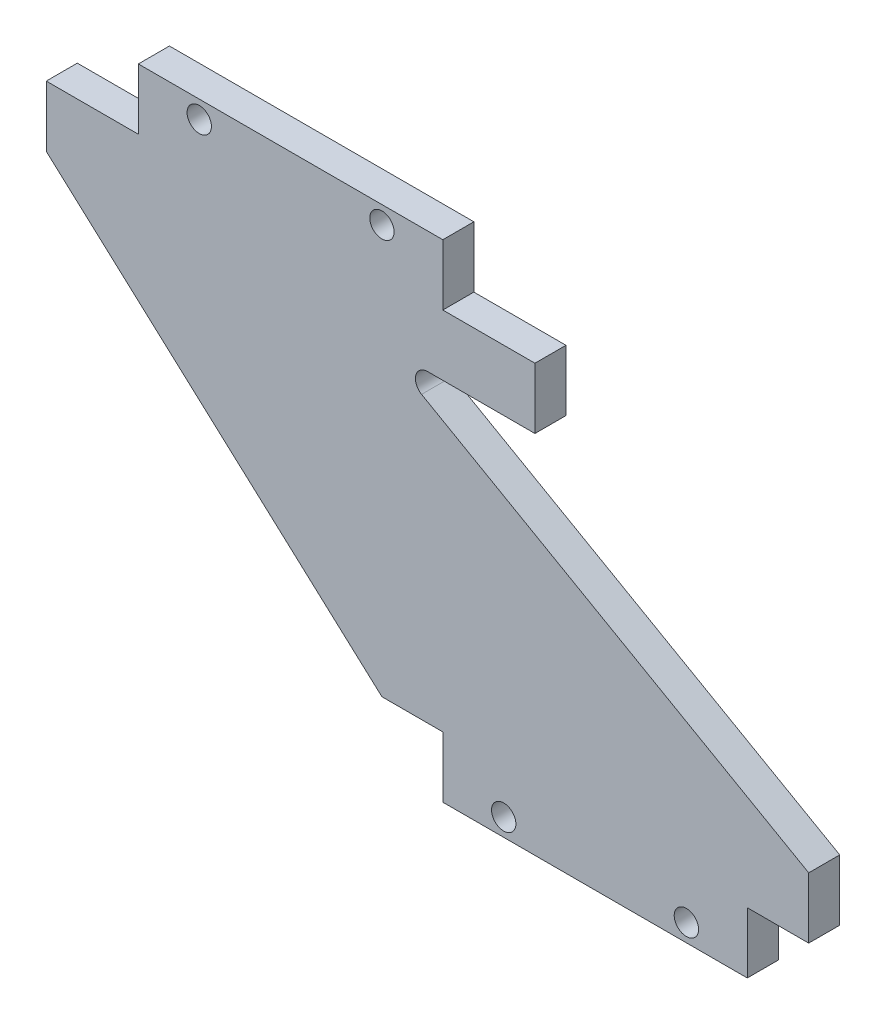
from build123d import *

# Parameters (mm, degrees)
SKETCH1_R           = 2
BOSS_EXTRUDE1_DEPTH = 5.1


with BuildPart() as part:
    # Sketch1 → Boss-Extrude1 (new body)
    with BuildSketch(Plane.XY):
        with BuildLine():
            Line((-42.484250182, 62.101563959), (-42.484250182, 52.101563959))
            Line((-42.484250182, 52.101563959), (-57.610510686, 52.101563959))
            Line((-57.610510686, 52.101563959), (-57.610510686, 42.101563959))
            Line((-57.610510686, 42.101563959), (-2.484250182, -7.898436041))
            Line((-2.484250182, -7.898436041), (7.515749818, -7.898436041))
            Line((7.515749818, -7.898436041), (7.515749818, -17.898436041))
            Line((7.515749818, -17.898436041), (57.515749818, -17.898436041))
            Line((57.515749818, -17.898436041), (57.515749818, -7.898436041))
            Line((57.515749818, -7.898436041), (67.599923488, -7.898436041))
            Line((67.599923488, -7.898436041), (67.599923488, 2.101563959))
            Line((67.599923488, 2.101563959), (4.022842983, 38.364289155))
            ThreePointArc((4.022842983, 38.364289155), (3.080536426, 40.614131219), (5.013739676, 42.101563959))
            Line((5.013739676, 42.101563959), (22.642010323, 42.101563959))
            Line((22.642010323, 42.101563959), (22.642010323, 52.101563959))
            Line((22.642010323, 52.101563959), (7.515749818, 52.101563959))
            Line((7.515749818, 52.101563959), (7.515749818, 62.101563959))
            Line((7.515749818, 62.101563959), (-42.484250182, 62.101563959))
        make_face()
        with Locations((-32.484250182, 59.201563959)):
            Circle(SKETCH1_R, mode=Mode.SUBTRACT)
        with Locations((-2.484250182, 59.201563959)):
            Circle(SKETCH1_R, mode=Mode.SUBTRACT)
        with Locations((17.515749818, -14.998436041)):
            Circle(SKETCH1_R, mode=Mode.SUBTRACT)
        with Locations((47.515749818, -14.998436041)):
            Circle(SKETCH1_R, mode=Mode.SUBTRACT)
    extrude(amount=BOSS_EXTRUDE1_DEPTH)


solid = part.part
